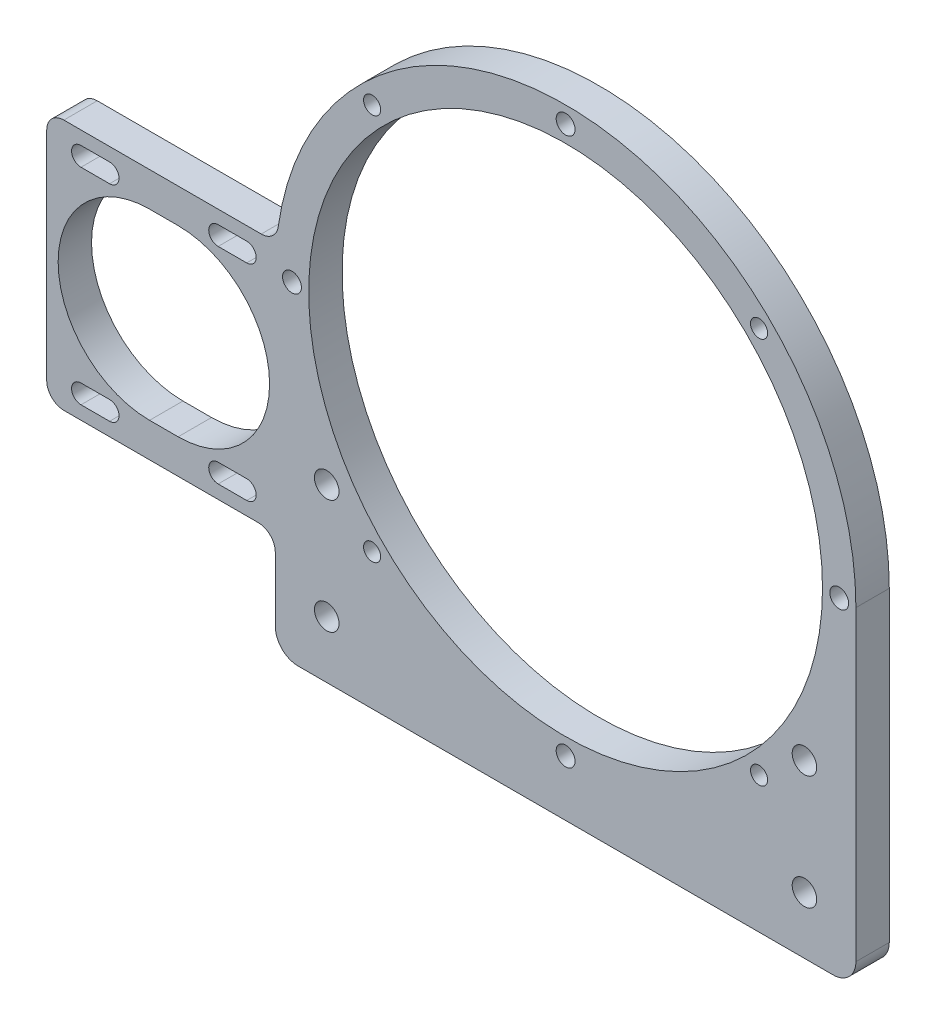
from build123d import *

# Parameters (mm, degrees)
SKETCH1_R           = 2.15
SKETCH1_R_2         = 1.5
SKETCH1_R_3         = 1.65
SKETCH1_R_4         = 44.958
BOSS_EXTRUDE1_DEPTH = 5.842
FILLET1_R           = 4
BOSS_EXTRUDE2_DEPTH = 5.842
FILLET2_R           = 3


with BuildPart() as part:
    # Sketch1 → Boss-Extrude1 (new body)
    # profile 1 of 2: a face of its own
    with BuildSketch(Plane.XY):
        with BuildLine():
            ThreePointArc((50.8, 0), (0, 50.8), (-50.8, 0))
            Line((-50.8, 0), (-50.8, -57.658))
            Line((-50.8, -57.658), (0, -57.658))
            Line((0, -57.658), (50.8, -57.658))
            Line((50.8, -57.658), (50.8, 0))
        make_face()
        with Locations((-41.8, -47.658)):
            Circle(SKETCH1_R, mode=Mode.SUBTRACT)
        with Locations((-33.855565576, -33.855565576)):
            Circle(SKETCH1_R_2, mode=Mode.SUBTRACT)
        with Locations((-41.8, -27.658)):
            Circle(SKETCH1_R, mode=Mode.SUBTRACT)
        with Locations((0, -47.879)):
            Circle(SKETCH1_R_3, mode=Mode.SUBTRACT)
        with Locations((41.8, -47.658)):
            Circle(SKETCH1_R, mode=Mode.SUBTRACT)
        with Locations((33.855565576, -33.855565576)):
            Circle(SKETCH1_R_2, mode=Mode.SUBTRACT)
        with Locations((41.8, -27.658)):
            Circle(SKETCH1_R, mode=Mode.SUBTRACT)
        with Locations((-47.879, 0)):
            Circle(SKETCH1_R_3, mode=Mode.SUBTRACT)
        Circle(SKETCH1_R_4, mode=Mode.SUBTRACT)
        with Locations((-33.855565576, 33.855565576)):
            Circle(SKETCH1_R_2, mode=Mode.SUBTRACT)
        with Locations((0, 47.879)):
            Circle(SKETCH1_R_3, mode=Mode.SUBTRACT)
        with Locations((47.879, 0)):
            Circle(SKETCH1_R_3, mode=Mode.SUBTRACT)
        with Locations((33.855565576, 33.855565576)):
            Circle(SKETCH1_R_2, mode=Mode.SUBTRACT)
    # profile 2 of 2: a face of its own
    with BuildSketch(Plane.XY):
        with BuildLine():
            ThreePointArc((50.8, 0), (0, 50.8), (-50.8, 0))
            Line((-50.8, 0), (-50.8, -57.658))
            Line((-50.8, -57.658), (0, -57.658))
            Line((0, -57.658), (50.8, -57.658))
            Line((50.8, -57.658), (50.8, 0))
        make_face()
        with Locations((-41.8, -47.658)):
            Circle(SKETCH1_R, mode=Mode.SUBTRACT)
        with Locations((-33.855565576, -33.855565576)):
            Circle(SKETCH1_R_2, mode=Mode.SUBTRACT)
        with Locations((-41.8, -27.658)):
            Circle(SKETCH1_R, mode=Mode.SUBTRACT)
        with Locations((0, -47.879)):
            Circle(SKETCH1_R_3, mode=Mode.SUBTRACT)
        with Locations((41.8, -47.658)):
            Circle(SKETCH1_R, mode=Mode.SUBTRACT)
        with Locations((33.855565576, -33.855565576)):
            Circle(SKETCH1_R_2, mode=Mode.SUBTRACT)
        with Locations((41.8, -27.658)):
            Circle(SKETCH1_R, mode=Mode.SUBTRACT)
        with Locations((-47.879, 0)):
            Circle(SKETCH1_R_3, mode=Mode.SUBTRACT)
        Circle(SKETCH1_R_4, mode=Mode.SUBTRACT)
        with Locations((-33.855565576, 33.855565576)):
            Circle(SKETCH1_R_2, mode=Mode.SUBTRACT)
        with Locations((0, 47.879)):
            Circle(SKETCH1_R_3, mode=Mode.SUBTRACT)
        with Locations((47.879, 0)):
            Circle(SKETCH1_R_3, mode=Mode.SUBTRACT)
        with Locations((33.855565576, 33.855565576)):
            Circle(SKETCH1_R_2, mode=Mode.SUBTRACT)
    extrude(amount=BOSS_EXTRUDE1_DEPTH)

    # Fillet1
    fillet1_edges = [part.edges().sort_by_distance(p)[0] for p in [
        (50.8, -57.658, 2.921),
        (-50.8, -57.658, 2.921),
    ]]
    fillet(fillet1_edges, radius=FILLET1_R)

    # Sketch2 → Boss-Extrude2 (add, through all)
    with BuildSketch(Plane.XY.offset(5.842)):
        Polygon((-50.8, -39.411490459), (-50.592347052, 4.588509541), (-90.8, 4.588509541), (-90.8, -39.411490459), align=None)
        with BuildLine():
            ThreePointArc((-79.8, -33.761490459), (-78.15, -35.411490459), (-79.8, -37.061490459))
            Line((-79.8, -37.061490459), (-84.8, -37.061490459))
            ThreePointArc((-84.8, -37.061490459), (-86.45, -35.411490459), (-84.8, -33.761490459))
            Line((-84.8, -33.761490459), (-79.8, -33.761490459))
        make_face(mode=Mode.SUBTRACT)
        with BuildLine():
            ThreePointArc((-55.8, -33.761490459), (-54.15, -35.411490459), (-55.8, -37.061490459))
            Line((-55.8, -37.061490459), (-60.8, -37.061490459))
            ThreePointArc((-60.8, -37.061490459), (-62.45, -35.411490459), (-60.8, -33.761490459))
            Line((-60.8, -33.761490459), (-55.8, -33.761490459))
        make_face(mode=Mode.SUBTRACT)
        with BuildLine():
            ThreePointArc((-79.8, 2.238509541), (-78.15, 0.588509541), (-79.8, -1.061490459))
            Line((-79.8, -1.061490459), (-84.8, -1.061490459))
            ThreePointArc((-84.8, -1.061490459), (-86.45, 0.588509541), (-84.8, 2.238509541))
            Line((-84.8, 2.238509541), (-79.8, 2.238509541))
        make_face(mode=Mode.SUBTRACT)
        with BuildLine():
            ThreePointArc((-67.8, -1.411490459), (-51.8, -17.411490459), (-67.8, -33.411490459))
            Line((-67.8, -33.411490459), (-72.8, -33.411490459))
            ThreePointArc((-72.8, -33.411490459), (-88.8, -17.411490459), (-72.8, -1.411490459))
            Line((-72.8, -1.411490459), (-67.8, -1.411490459))
        make_face(mode=Mode.SUBTRACT)
        with BuildLine():
            ThreePointArc((-55.8, 2.238509541), (-54.15, 0.588509541), (-55.8, -1.061490459))
            Line((-55.8, -1.061490459), (-60.8, -1.061490459))
            ThreePointArc((-60.8, -1.061490459), (-62.45, 0.588509541), (-60.8, 2.238509541))
            Line((-60.8, 2.238509541), (-55.8, 2.238509541))
        make_face(mode=Mode.SUBTRACT)
    extrude(amount=-BOSS_EXTRUDE2_DEPTH)

    # Fillet2
    fillet2_edges = [part.edges().sort_by_distance(p)[0] for p in [
        (-50.592347052, 4.588509541, 2.921),
        (-50.8, -39.411490459, 2.921),
        (-90.8, -39.411490459, 2.921),
        (-90.8, 4.588509541, 2.921),
    ]]
    fillet(fillet2_edges, radius=FILLET2_R)


solid = part.part
